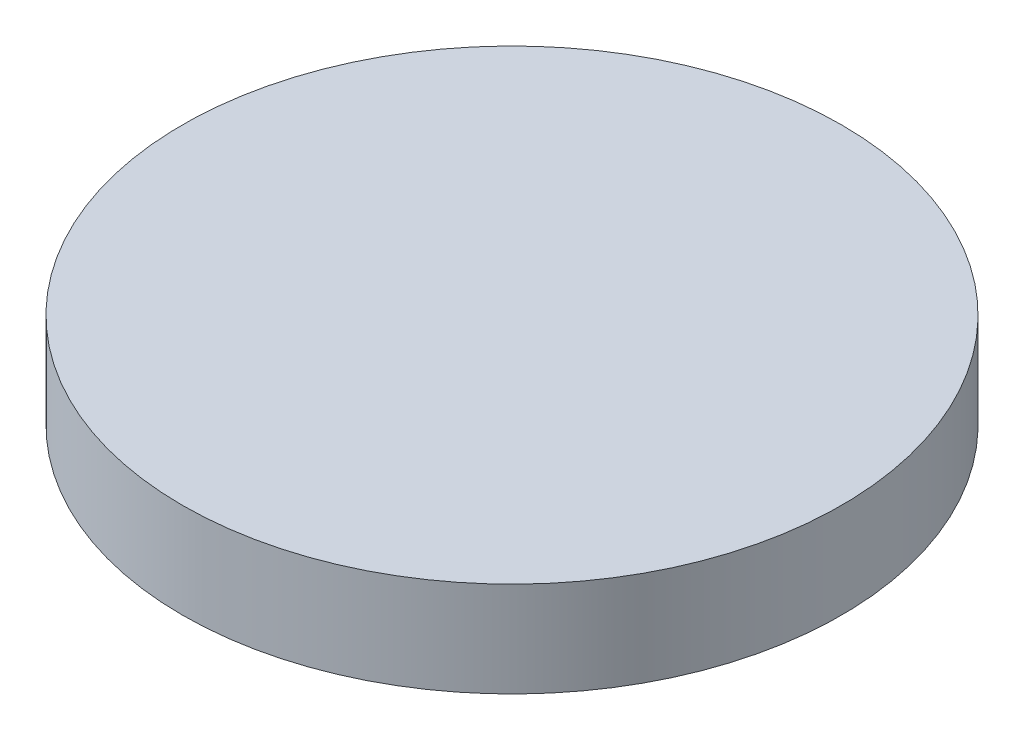
from build123d import *

# Parameters (mm, degrees)
SKETCH1_R           = 5.5
BOSS_EXTRUDE1_DEPTH = 1.5875


with BuildPart() as part:
    # Sketch1 → Boss-Extrude1 (new body)
    with BuildSketch(Plane(origin=(0, 0, 0), x_dir=(1, 0, 0), z_dir=(0, 1, 0))):
        with Locations(Location((0, 0, 0), (0, 0, 270))):
            Circle(SKETCH1_R)
    extrude(amount=BOSS_EXTRUDE1_DEPTH)


solid = part.part
